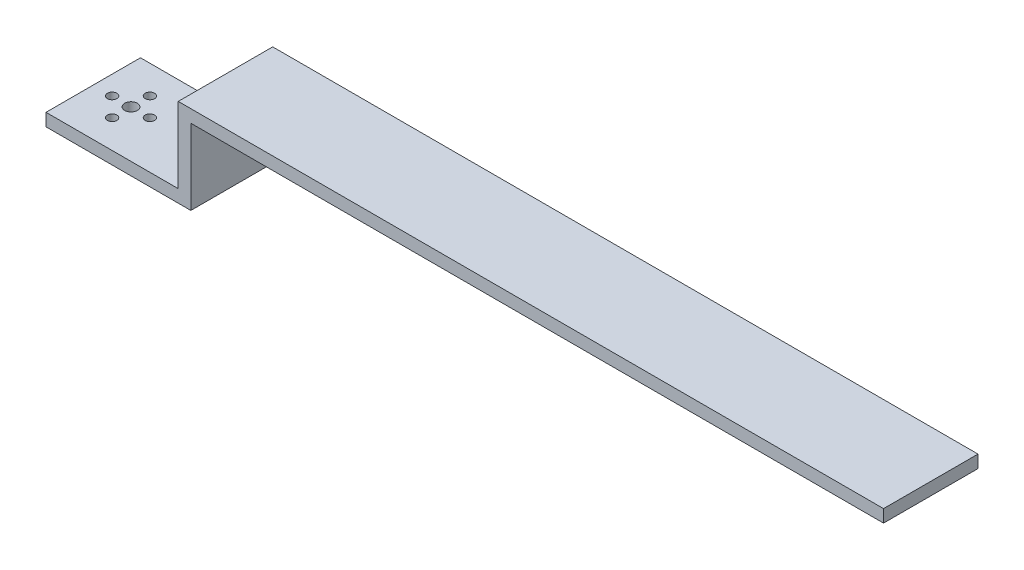
from build123d import *

# Parameters (mm, degrees)
SKETCH1_W           = 46
SKETCH1_H           = 30
SKETCH1_R           = 1.5
SKETCH1_R_2         = 2
BOSS_EXTRUDE1_DEPTH = 4
SKETCH2_W           = 4
SKETCH2_H           = 30
BOSS_EXTRUDE2_DEPTH = 24
SKETCH3_W           = 30
SKETCH3_H           = 4
BOSS_EXTRUDE3_DEPTH = 220


with BuildPart() as part:
    # Sketch1 → Boss-Extrude1 (new body)
    with BuildSketch(Plane(origin=(0, 0, 0), x_dir=(1, 0, 0), z_dir=(0, 1, 0))):
        Rectangle(SKETCH1_W, SKETCH1_H)
        with Locations(Location((-17, 0, 0), (0, 0, 270))):
            Circle(SKETCH1_R, mode=Mode.SUBTRACT)
        with Locations(Location((-11, 6, 0), (0, 0, 270))):
            Circle(SKETCH1_R, mode=Mode.SUBTRACT)
        with Locations(Location((-5, 0, 0), (0, 0, 270))):
            Circle(SKETCH1_R, mode=Mode.SUBTRACT)
        with Locations(Location((-11, -6, 0), (0, 0, 270))):
            Circle(SKETCH1_R, mode=Mode.SUBTRACT)
        with Locations(Location((-11, 0, 0), (0, 0, 270))):
            Circle(SKETCH1_R_2, mode=Mode.SUBTRACT)
    extrude(amount=BOSS_EXTRUDE1_DEPTH)

    # Sketch2 → Boss-Extrude2 (add)
    with BuildSketch(Plane(origin=(0, 4, 0), x_dir=(1, 0, 0), z_dir=(0, 1, 0))):
        with Locations((21, 0)):
            Rectangle(SKETCH2_W, SKETCH2_H)
    extrude(amount=BOSS_EXTRUDE2_DEPTH)

    # Sketch3 → Boss-Extrude3 (add)
    with BuildSketch(Plane(origin=(23, 0, 0), x_dir=(0, 0, -1), z_dir=(1, 0, 0))):
        with Locations((0, 26)):
            Rectangle(SKETCH3_W, SKETCH3_H)
    extrude(amount=BOSS_EXTRUDE3_DEPTH)


solid = part.part
